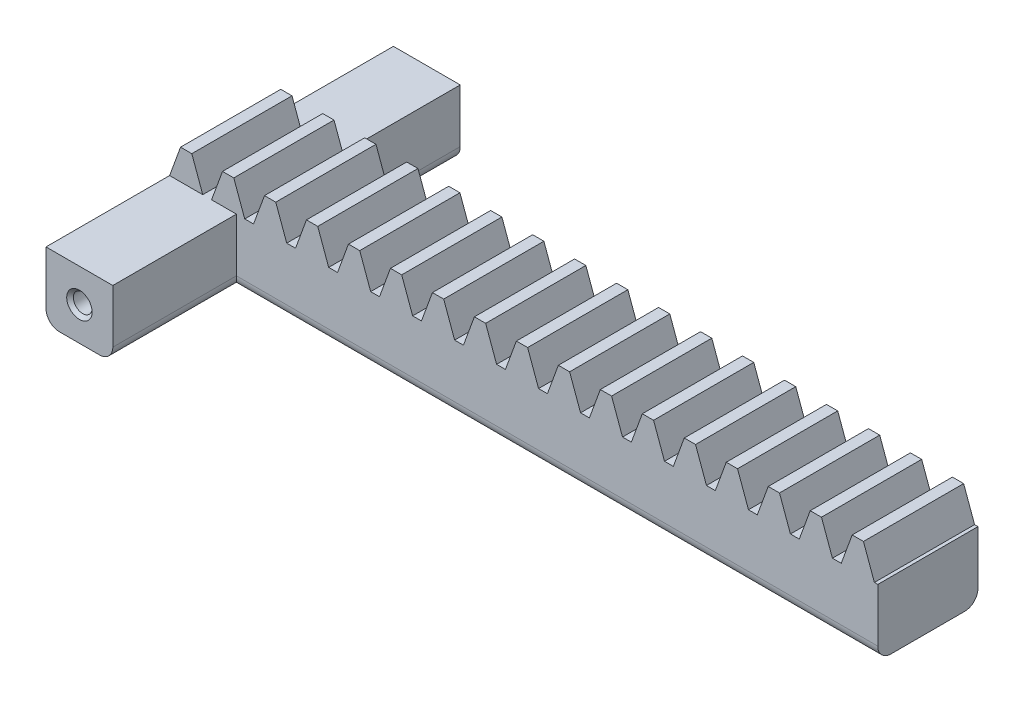
from build123d import *

# Parameters (mm, degrees)
SKETCH_1_W             = 106
SKETCH_1_H             = 10
EXTRUDE_1_DEPTH        = 7.5
EXTRUDE_2_DEPTH        = 15
PATTERN_LINEAR_1_COUNT = 17
PATTERN_LINEAR_1_PITCH = 6.283185307
SKETCH_3_W             = 10
SKETCH_3_H             = 10
EXTRUDE_1_2_DEPTH      = 18.5
SKETCH_4_R             = 1.4
CUT_EXTRUDE_1_DEPTH    = 119.490505949
FILLET_2_R             = 2
FILLET_3_R             = 2
CHAMFER_1_SIZE         = 0.5


with BuildPart() as part:
    # 草图1 → Extrude 1 (new, symmetric)
    with BuildSketch(Plane.XY):
        with Locations((53, -5)):
            Rectangle(SKETCH_1_W, SKETCH_1_H)
    extrude(amount=EXTRUDE_1_DEPTH, both=True)

    # 草图2 → 拉伸2 (add)
    with BuildSketch(Plane.XY.offset(7.5)):
        Polygon((0, 0), (1.637866054, 4.5), (3.323577771, 4.5), (4.961443825, 0), align=None)
    extrude_2 = extrude(amount=-EXTRUDE_2_DEPTH)

    # 阵列(线性)1: 拉伸2 ×17
    with Locations(*[(i * PATTERN_LINEAR_1_PITCH, 0, 0) for i in range(1, PATTERN_LINEAR_1_COUNT)]):
        add(extrude_2)

    # 草图3 → Extrude 1 2 (add)
    with BuildSketch(Plane.XY.offset(7.5)):
        with Locations((5, -5)):
            Rectangle(SKETCH_3_W, SKETCH_3_H)
    extrude_1_2 = extrude(amount=EXTRUDE_1_2_DEPTH)

    # 镜向1: Extrude 1 2 across plane
    add(extrude_1_2.mirror(Plane.XY))

    # 草图4 → 切除-拉伸1 (cut, through all)
    with BuildSketch(Plane.XY.offset(26)):
        with Locations((5, -5)):
            Circle(SKETCH_4_R)
    extrude(amount=-CUT_EXTRUDE_1_DEPTH, mode=Mode.SUBTRACT)

    # 圆角2
    fillet_2_edges = [part.edges().sort_by_distance(p)[0] for p in [
        (58, -10, 7.5),
        (58, -10, -7.5),
    ]]
    fillet(fillet_2_edges, radius=FILLET_2_R)

    # 圆角3
    fillet_3_edges = [part.edges().sort_by_distance(p)[0] for p in [
        (10, -10, 15.75),
        (10, -10, -15.75),
        (0, -10, 0),
    ]]
    fillet(fillet_3_edges, radius=FILLET_3_R)

    # 倒角1
    chamfer_1_edges = [part.edges().sort_by_distance(p)[0] for p in [
        (3.6, -5, -26),
        (3.6, -5, 26),
    ]]
    chamfer(chamfer_1_edges, length=CHAMFER_1_SIZE)


solid = part.part
